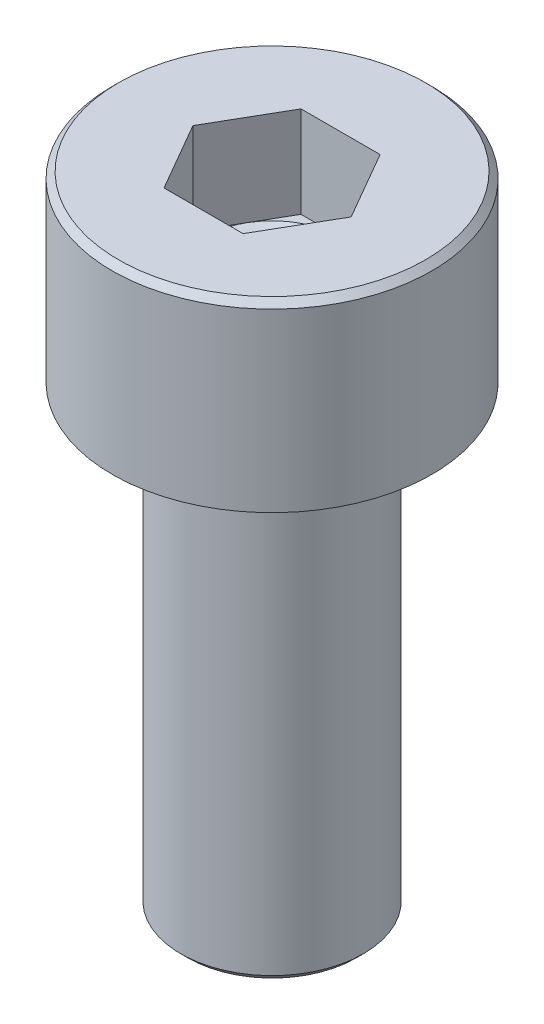
from build123d import *

# Parameters (mm, degrees)
CHAMFER_1_SIZE      = 0.16
CHAMFER_2_SIZE      = 0.14
CUT_EXTRUDE_1_DEPTH = 2
CUT_EXTRUDE_2_REACH = 16.849
SKETCH_4_R          = 0.75


with BuildPart() as part:
    # 草图2 → 旋转1 (revolve)
    with BuildSketch(Plane.XY):
        Polygon((-1.5, 0), (-1.5, -2), (0, -2.866025404), (0, -14), (-2, -14), (-2, -4), (-3.5, -4), (-3.5, 0), align=None)
    revolve(axis=Axis((0, -2.866025404, 0), (0, -1, 0)))

    # 倒角1
    chamfer_1_edges = [part.edges().sort_by_distance(p)[0] for p in [
        (2, -14, 0),
    ]]
    chamfer(chamfer_1_edges, length=CHAMFER_1_SIZE)

    # 倒角2
    chamfer_2_edges = [part.edges().sort_by_distance(p)[0] for p in [
        (3.5, 0, 0),
    ]]
    chamfer(chamfer_2_edges, length=CHAMFER_2_SIZE)

    # 草图3 → 切除-拉伸1 (cut)
    with BuildSketch(Plane(origin=(0, 0, 0), x_dir=(-1, 0, 0), z_dir=(0, 1, 0))):
        Polygon((-0.866025404, 1.5), (-1.732050808, 0), (-0.866025404, -1.5), (0.866025404, -1.5), (1.732050808, 0), (0.866025404, 1.5), align=None)
    extrude(amount=-CUT_EXTRUDE_1_DEPTH, mode=Mode.SUBTRACT)

    # 切除-拉伸2: up to this cone (the profile starts outside it)
    cut_extrude_2_end = Plane(origin=(0, -14, 0), z_dir=(0, 1, 0)).offset(11.133975596) * Cone(1.732e-06, 10.76473977, 6.215024404, align=(Align.CENTER, Align.CENTER, Align.MIN), mode=Mode.PRIVATE)
    # 草图4 → 切除-拉伸2 (cut, up to the surface)
    with BuildSketch(Plane.XZ.offset(14), mode=Mode.PRIVATE) as cut_extrude_2_sk1:
        Circle(SKETCH_4_R)
    cut_extrude_2_tool1 = extrude(cut_extrude_2_sk1.sketch, amount=-CUT_EXTRUDE_2_REACH, mode=Mode.PRIVATE) - cut_extrude_2_end
    add(cut_extrude_2_tool1.solids().sort_by_distance((0, -14, 0))[0], mode=Mode.SUBTRACT)


solid = part.part
